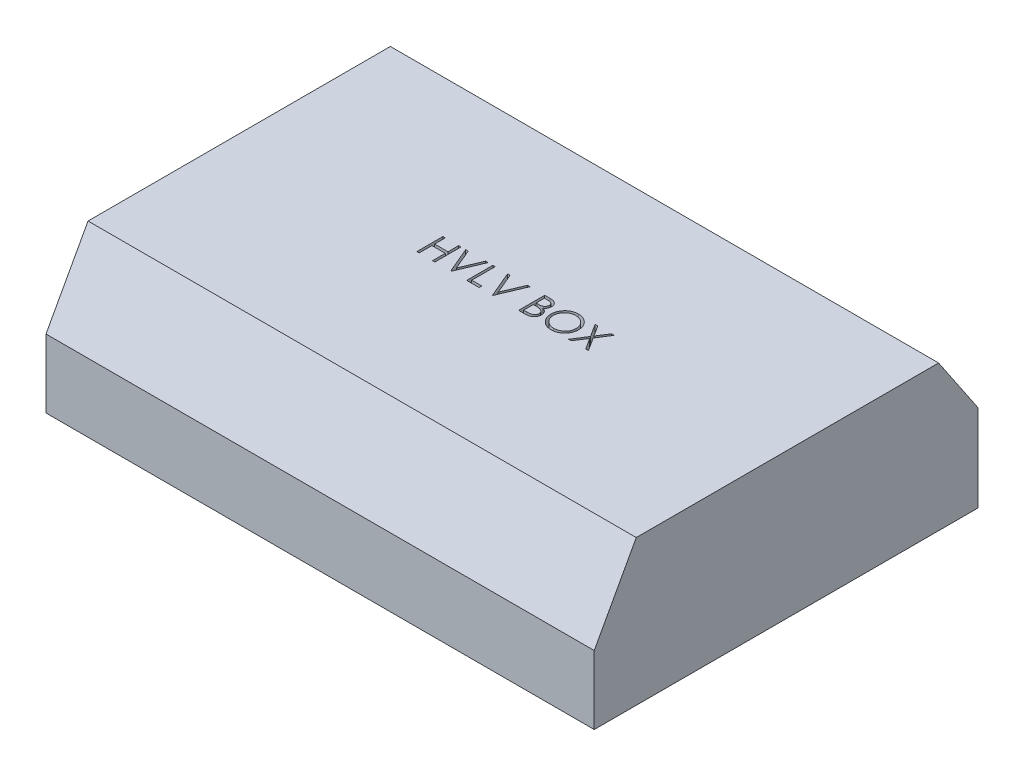
from build123d import *

# Parameters (mm, degrees)
BOSS_EXTRUDE1_DEPTH      = 53
BOSS_EXTRUDE1_DEPTH_BACK = 53
SKETCH1_W                = 400
SKETCH1_H                = 280
CUT_EXTRUDE1_DEPTH       = 53
CUT_EXTRUDE2_DEPTH       = 428.093666681


with BuildPart() as part:
    # Sketch1 → Boss-Extrude1 (new, two sides: drawn at the far end of the back side and taken through both)
    with BuildSketch(Plane(origin=(0, 0, 0), x_dir=(1, 0, 0), z_dir=(0, 1, 0)).offset(-BOSS_EXTRUDE1_DEPTH_BACK)):
        Rectangle(SKETCH1_W, SKETCH1_H)
    extrude(amount=BOSS_EXTRUDE1_DEPTH + BOSS_EXTRUDE1_DEPTH_BACK)

    # Sketch2 → Cut-Extrude1 (cut)
    # profile 1 of 7: a face of its own
    with BuildSketch(Plane(origin=(0, 53, 0), x_dir=(1, 0, 0), z_dir=(0, 1, 0))):
        Polygon((-60.725071742, 10.351541193), (-59.015456358, 10.351541193), (-59.015456358, 2.536156577), (-49.246225588, 2.536156577), (-49.246225588, 10.351541193), (-47.536610204, 10.351541193), (-47.536610204, -8.698458807), (-49.246225588, -8.698458807), (-49.246225588, 0.582310423), (-59.015456358, 0.582310423), (-59.015456358, -8.698458807), (-60.725071742, -8.698458807), align=None)
    # profile 2 of 7: a face of its own
    with BuildSketch(Plane(origin=(0, 53, 0), x_dir=(1, 0, 0), z_dir=(0, 1, 0))):
        Polygon((-44.117379435, 10.351541193), (-42.285648665, 10.351541193), (-35.935648665, -4.661018904), (-29.585648665, 10.351541193), (-27.753917896, 10.351541193), (-35.813533281, -8.698458807), (-36.05776405, -8.698458807), align=None)
    # profile 3 of 7: a face of its own
    with BuildSketch(Plane(origin=(0, 53, 0), x_dir=(1, 0, 0), z_dir=(0, 1, 0))):
        Polygon((-24.334687127, 10.351541193), (-22.625071742, 10.351541193), (-22.625071742, -6.744612654), (-15.298148665, -6.744612654), (-15.298148665, -8.698458807), (-24.334687127, -8.698458807), align=None)
    # profile 4 of 7: a face of its own
    with BuildSketch(Plane(origin=(0, 53, 0), x_dir=(1, 0, 0), z_dir=(0, 1, 0))):
        Polygon((-13.588533281, 10.351541193), (-11.756802512, 10.351541193), (-5.406802512, -4.661018904), (0.943197488, 10.351541193), (2.774928258, 10.351541193), (-5.284687127, -8.698458807), (-5.528917896, -8.698458807), align=None)
    # profile 5 of 7: a face of its own
    with BuildSketch(Plane(origin=(0, 53, 0), x_dir=(1, 0, 0), z_dir=(0, 1, 0))):
        with BuildLine():
            Line((13.521082104, 10.351541193), (17.237969123, 10.351541193))
            add(Edge.make_bspline(
                [(17.237969123, 10.351541193), (17.419915554, 10.350584608), (17.772573021, 10.34873051), (18.285395983, 10.319975182), (18.765721652, 10.280766636), (19.213689327, 10.218554274), (19.629092007, 10.143487601), (20.013181576, 10.052582002), (20.364736656, 9.943580005), (20.784450264, 9.770245246), (21.262989861, 9.512672001), (21.781141113, 9.132060811), (22.224212759, 8.666519833), (22.606226857, 8.141378523), (22.909944379, 7.563696679), (23.129668698, 6.947243095), (23.268776562, 6.299969042), (23.283082754, 5.855596888), (23.290312873, 5.631018356)],
                knots=[0, 0, 0, 0, 1.001505555, 1.941167018, 2.826882275, 3.653841531, 4.429895133, 5.150066043, 5.825578002, 6.45369114, 7.647487171, 8.808567382, 9.977351308, 11.170798116, 12.373658725, 13.556498008, 14.765093433, 16, 16, 16, 16], degree=3))
            add(Edge.make_bspline(
                [(23.290312873, 5.631018356), (23.284362641, 5.420638017), (23.272669875, 5.007220812), (23.16085857, 4.402551446), (22.985812646, 3.826962669), (22.742488362, 3.282555114), (22.426247497, 2.781629305), (22.051461505, 2.320144329), (21.599286337, 1.91763929), (21.260505274, 1.692615777), (21.088419844, 1.578314029)],
                knots=[0, 0, 0, 0, 1.044552857, 2.05264487, 3.044412934, 4.028983338, 5.005914585, 5.980388656, 6.974128949, 8, 8, 8, 8], degree=3))
            add(Edge.make_bspline(
                [(21.088419844, 1.578314029), (21.304830172, 1.495228821), (21.718876737, 1.336266235), (22.288667747, 1.055221781), (22.779585403, 0.749539437), (23.195404155, 0.415718939), (23.551027677, 0.055898126), (23.861558687, -0.335198996), (24.126524453, -0.762674236), (24.353561937, -1.222070621), (24.530720166, -1.708697256), (24.663394731, -2.217989623), (24.739417561, -2.748121488), (24.750236009, -3.108903338), (24.755697488, -3.291036932)],
                knots=[0, 0, 0, 0, 1.27268992, 2.434971085, 3.483601985, 4.442670788, 5.356604649, 6.2567628, 7.179492994, 8.113709626, 9.066344395, 10.018646069, 10.999752585, 12, 12, 12, 12], degree=3))
            add(Edge.make_bspline(
                [(24.755697488, -3.291036932), (24.750380655, -3.477002336), (24.739919637, -3.842894479), (24.662740076, -4.380404568), (24.532061936, -4.89407392), (24.352060411, -5.387224986), (24.117134099, -5.858903718), (23.831231893, -6.309644484), (23.490337239, -6.734918483), (23.108995053, -7.139451346), (22.677582518, -7.503185446), (22.21213248, -7.827120935), (21.706783225, -8.093527359), (21.169834515, -8.31731599), (20.595263023, -8.488260884), (19.985648831, -8.607854465), (19.341517703, -8.688436167), (18.899504629, -8.695061239), (18.672824892, -8.698458807)],
                knots=[0, 0, 0, 0, 0.978564426, 1.925352924, 2.850884081, 3.763762016, 4.682927383, 5.618979971, 6.567305752, 7.547517671, 8.540179244, 9.531824382, 10.526200242, 11.540722885, 12.589160233, 13.674978461, 14.80764778, 16, 16, 16, 16], degree=3))
            Line((18.672824892, -8.698458807), (13.521082104, -8.698458807))
            Line((13.521082104, -8.698458807), (13.521082104, 10.351541193))
        make_face()
        with BuildLine():
            Line((15.230697488, 8.397695039), (15.230697488, 2.291925808))
            Line((15.230697488, 2.291925808), (16.379345325, 2.291925808))
            add(Edge.make_bspline(
                [(16.379345325, 2.291925808), (16.547250911, 2.294102532), (16.871678721, 2.298308406), (17.341505586, 2.310356263), (17.777614614, 2.344091328), (18.17925302, 2.377816697), (18.545788322, 2.432651238), (18.876408482, 2.49792265), (19.176302274, 2.566953891), (19.522138944, 2.684353527), (19.914421706, 2.857859159), (20.332613316, 3.127127295), (20.701282357, 3.447844132), (21.012598479, 3.817909224), (21.267386626, 4.225395178), (21.444354132, 4.663800342), (21.564354351, 5.122198489), (21.575193971, 5.436894979), (21.580697488, 5.596673404)],
                knots=[0, 0, 0, 0, 1.156816544, 2.235205308, 3.236616184, 4.169592532, 5.011045266, 5.787822928, 6.49130361, 7.128639758, 8.301311294, 9.436451833, 10.541879658, 11.654887649, 12.756523258, 13.837046038, 14.901820046, 16, 16, 16, 16], degree=3))
            add(Edge.make_bspline(
                [(21.580697488, 5.596673404), (21.577833565, 5.702405103), (21.572215666, 5.909809377), (21.526205548, 6.212156576), (21.448004892, 6.496511858), (21.347560811, 6.766772087), (21.207196662, 7.014486586), (21.041932669, 7.248220265), (20.842257698, 7.460013367), (20.61497861, 7.657967351), (20.353674534, 7.83346971), (20.05850136, 7.987180149), (19.725465575, 8.110954948), (19.360179893, 8.219355721), (18.957021545, 8.295492006), (18.520642905, 8.35891973), (18.047469648, 8.391210797), (17.720108447, 8.395485415), (17.550889796, 8.397695039)],
                knots=[0, 0, 0, 0, 0.91205012, 1.789085906, 2.630437955, 3.453916878, 4.269457761, 5.079663411, 5.91843418, 6.774407191, 7.675494373, 8.627863946, 9.638891023, 10.736472738, 11.911756761, 13.175263542, 14.539845004, 16, 16, 16, 16], degree=3))
            Line((17.550889796, 8.397695039), (15.230697488, 8.397695039))
        make_face(mode=Mode.SUBTRACT)
        with BuildLine():
            Line((15.230697488, 0.338079654), (15.230697488, -6.744612654))
            Line((15.230697488, -6.744612654), (17.665372969, -6.744612654))
            add(Edge.make_bspline(
                [(17.665372969, -6.744612654), (17.839647409, -6.742523971), (18.175538416, -6.738498312), (18.660503683, -6.725356236), (19.109991719, -6.695462564), (19.52195143, -6.648404439), (19.900831179, -6.59735888), (20.24208582, -6.52871748), (20.54848163, -6.450073852), (20.903760362, -6.328512143), (21.303829457, -6.139664208), (21.734962833, -5.854925348), (22.118282677, -5.515708487), (22.443794159, -5.123110225), (22.710564854, -4.696219717), (22.904632402, -4.243671455), (23.024325494, -3.772943085), (23.038815301, -3.451995692), (23.046082104, -3.291036932)],
                knots=[0, 0, 0, 0, 1.160039823, 2.235823828, 3.228722157, 4.157150951, 4.99529583, 5.772374946, 6.472645482, 7.099169577, 8.269452708, 9.405989375, 10.527446681, 11.663510218, 12.788923519, 13.866172445, 14.929861265, 16, 16, 16, 16], degree=3))
            add(Edge.make_bspline(
                [(23.046082104, -3.291036932), (23.044579307, -3.190380322), (23.041597955, -2.990690701), (22.996636608, -2.697234599), (22.931246831, -2.412976632), (22.846711455, -2.13714493), (22.723596927, -1.87472641), (22.579869875, -1.62053105), (22.411351389, -1.374222827), (22.148765286, -1.062824704), (21.766829199, -0.70404782), (21.224139464, -0.352779415), (20.607070242, -0.069490636), (20.159517745, 0.050793657), (19.92832369, 0.112929414)],
                knots=[0, 0, 0, 0, 0.723448775, 1.435228256, 2.130040452, 2.821711965, 3.505591119, 4.210454504, 4.921174351, 5.648778258, 7.137944449, 8.670945889, 10.280296675, 12, 12, 12, 12], degree=3))
            add(Edge.make_bspline(
                [(19.92832369, 0.112929414), (19.835636754, 0.131734942), (19.634672359, 0.172509207), (19.3069711, 0.215549707), (18.932851585, 0.253894961), (18.511449924, 0.282258548), (18.042232961, 0.311576735), (17.524198589, 0.322978547), (16.959462348, 0.336581663), (16.567618149, 0.33756755), (16.364080902, 0.338079654)],
                knots=[0, 0, 0, 0, 0.634451884, 1.375622551, 2.216452059, 3.157844607, 4.20941857, 5.370758133, 6.634282058, 8, 8, 8, 8], degree=3))
            Line((16.364080902, 0.338079654), (15.230697488, 0.338079654))
        make_face(mode=Mode.SUBTRACT)
    # profile 6 of 7: a face of its own
    with BuildSketch(Plane(origin=(0, 53, 0), x_dir=(1, 0, 0), z_dir=(0, 1, 0))):
        with BuildLine():
            add(Edge.make_bspline(
                [(37.577812873, 10.840002731), (37.930554135, 10.831068393), (38.623367077, 10.813520617), (39.64158902, 10.679195782), (40.61365661, 10.446810874), (41.547488366, 10.137313783), (42.431914424, 9.7244492), (43.273591824, 9.225420035), (44.070517952, 8.634998167), (44.811951471, 7.957747661), (45.490441444, 7.220874862), (46.088208053, 6.434502237), (46.589181109, 5.60338447), (47.000583751, 4.730019092), (47.323337612, 3.816381266), (47.546054121, 2.857600194), (47.688320338, 1.859888067), (47.704952498, 1.179384703), (47.713389796, 0.834173404)],
                knots=[0, 0, 0, 0, 1.065120563, 2.091984664, 3.0946048, 4.079830382, 5.057816894, 6.036188127, 7.030412546, 8.04752943, 9.064399622, 10.05169764, 11.02544977, 11.989514704, 12.962713494, 13.945757189, 14.957906945, 16, 16, 16, 16], degree=3))
            add(Edge.make_bspline(
                [(47.713389796, 0.834173404), (47.704953735, 0.491505018), (47.688325281, -0.183934071), (47.545892363, -1.175314817), (47.322512063, -2.128308465), (47.003580957, -3.041324089), (46.594139424, -3.915324829), (46.089830564, -4.748010964), (45.495790546, -5.539655477), (44.8197504, -6.28158584), (44.082781871, -6.961929216), (43.292314276, -7.554759097), (42.46612492, -8.064886118), (41.59358208, -8.471922972), (40.686257594, -8.797252996), (39.73603095, -9.01906374), (38.747354706, -9.162140361), (38.073142528, -9.178569712), (37.730457104, -9.186920346)],
                knots=[0, 0, 0, 0, 1.043624062, 2.057103931, 3.04512605, 4.022047818, 4.998200453, 5.980619268, 6.982898556, 8.009068085, 9.034988726, 10.034168286, 11.015286542, 11.987931943, 12.962482838, 13.94673481, 14.956375938, 16, 16, 16, 16], degree=3))
            add(Edge.make_bspline(
                [(37.730457104, -9.186920346), (37.385247596, -9.178487255), (36.704747764, -9.161863387), (35.7057819, -9.019361741), (34.746327323, -8.796524073), (33.829127782, -8.47806557), (32.953671808, -8.066491786), (32.118247215, -7.564636522), (31.326207285, -6.969149082), (30.584118637, -6.293328155), (29.905126572, -5.557608708), (29.313164828, -4.769296548), (28.811196711, -3.943857563), (28.401004858, -3.079001038), (28.076259729, -2.1789079), (27.854709219, -1.237574044), (27.711366394, -0.260366163), (27.694848159, 0.40498447), (27.686466719, 0.742586866)],
                knots=[0, 0, 0, 0, 1.053102029, 2.075944431, 3.073151272, 4.055350789, 5.033113405, 6.020478099, 7.024410459, 8.052272461, 9.079885166, 10.07527673, 11.055994387, 12.023226415, 12.992069828, 13.970394897, 14.97016774, 16, 16, 16, 16], degree=3))
            add(Edge.make_bspline(
                [(27.686466719, 0.742586866), (27.689376664, 0.969187536), (27.695159843, 1.419530209), (27.764783198, 2.088275561), (27.865811886, 2.746266141), (28.010602295, 3.391630872), (28.199968369, 4.022789946), (28.423408689, 4.644096241), (28.696312705, 5.249253366), (29.004817375, 5.841128112), (29.349142358, 6.410493999), (29.72946608, 6.948681445), (30.132430014, 7.460206585), (30.574190771, 7.931813848), (31.040188851, 8.377222749), (31.537983738, 8.789588395), (32.064537954, 9.172629199), (32.622117192, 9.517817056), (33.196982374, 9.830014631), (33.789583122, 10.097922135), (34.391871032, 10.327861412), (35.006667045, 10.514229332), (35.632338561, 10.661360843), (36.270251132, 10.761549439), (36.919896552, 10.831350369), (37.357563874, 10.837106202), (37.577812873, 10.840002731)],
                knots=[0, 0, 0, 0, 1.037015668, 2.060948919, 3.074880161, 4.083647147, 5.086022904, 6.090072063, 7.104153813, 8.122640571, 9.144368836, 10.147691507, 11.138137339, 12.123020368, 13.103399296, 14.087645067, 15.080126199, 16.082011238, 17.087798457, 18.072939717, 19.057185487, 20.037253025, 21.01195951, 21.997135196, 22.992090687, 24, 24, 24, 24], degree=3))
        make_face()
        with BuildLine():
            add(Edge.make_bspline(
                [(37.6617672, 8.886156577), (37.480984695, 8.883952817), (37.121147977, 8.879566366), (36.586199287, 8.821786543), (36.058286047, 8.739436718), (35.537299233, 8.621971584), (35.025418715, 8.461929525), (34.517873151, 8.277738296), (34.019290815, 8.053377789), (33.531317674, 7.799889212), (33.058251336, 7.519315801), (32.611867918, 7.209226611), (32.191011813, 6.876893623), (31.796713462, 6.521541251), (31.430130654, 6.141359847), (31.084048207, 5.742113016), (30.772338056, 5.312389152), (30.486666559, 4.863841081), (30.231027314, 4.397053046), (30.003704455, 3.916939367), (29.817754635, 3.419583672), (29.666103701, 2.910381757), (29.540374731, 2.390140083), (29.460724373, 1.854912106), (29.402309673, 1.307387282), (29.398173943, 0.937371762), (29.396082104, 0.750219077)],
                knots=[0, 0, 0, 0, 1.008559885, 2.007477868, 2.99961109, 3.989939068, 4.984837346, 5.991145699, 7.001802488, 8.033829008, 9.059044045, 10.069351652, 11.065060232, 12.050310815, 13.029377138, 14.011219647, 14.996725999, 15.989392538, 16.977580475, 17.965360261, 18.951710183, 19.937753436, 20.929683414, 21.935841486, 22.955955122, 24, 24, 24, 24], degree=3))
            add(Edge.make_bspline(
                [(29.396082104, 0.750219077), (29.403020995, 0.475016133), (29.416671942, -0.066393196), (29.536183859, -0.85978838), (29.720272034, -1.62226891), (29.991638557, -2.34966273), (30.331004046, -3.048222327), (30.750250405, -3.711750725), (31.246960571, -4.340427255), (31.811186337, -4.929862934), (32.42798564, -5.467866525), (33.082939499, -5.940107364), (33.769031277, -6.339668866), (34.488050137, -6.665179332), (35.236157457, -6.923114905), (36.018173842, -7.099891454), (36.828889915, -7.216235004), (37.381506767, -7.227407861), (37.6617672, -7.233074192)],
                knots=[0, 0, 0, 0, 1.032063989, 2.030389145, 3.003944642, 3.970395727, 4.937377036, 5.913328081, 6.909231446, 7.93887556, 8.970685674, 9.976071282, 10.964166581, 11.944589148, 12.933237628, 13.927779006, 14.949070134, 16, 16, 16, 16], degree=3))
            add(Edge.make_bspline(
                [(37.6617672, -7.233074192), (37.850141773, -7.23048609), (38.223745128, -7.225353105), (38.779436471, -7.173653164), (39.325116709, -7.090748275), (39.860020461, -6.97138285), (40.383540649, -6.821991626), (40.897862363, -6.644512421), (41.397507343, -6.423090441), (41.888778746, -6.178445162), (42.359021147, -5.899552304), (42.807923687, -5.599987518), (43.224171521, -5.268144025), (43.618174895, -4.91807136), (43.986262745, -4.542710988), (44.325945931, -4.142550924), (44.63608065, -3.715065346), (44.921643669, -3.267197638), (45.176387142, -2.79913232), (45.398341953, -2.31727793), (45.586643669, -1.822820977), (45.738654531, -1.315048281), (45.857773973, -0.794924233), (45.939851822, -0.261752407), (45.997265467, 0.283400585), (46.001592959, 0.652120716), (46.003774412, 0.83798951)],
                knots=[0, 0, 0, 0, 1.047197238, 2.076906641, 3.100256066, 4.114471768, 5.12198147, 6.126382909, 7.136867548, 8.15857795, 9.17633901, 10.174870724, 11.156907918, 12.133735059, 13.104061851, 14.077631395, 15.04955518, 16.038496417, 17.029181396, 18.010275684, 18.986308667, 19.968651475, 20.955262928, 21.950658345, 22.966943676, 24, 24, 24, 24], degree=3))
            add(Edge.make_bspline(
                [(46.003774412, 0.83798951), (46.001591211, 1.022586755), (45.99726043, 1.388769393), (45.939879247, 1.930120419), (45.857687258, 2.459455756), (45.739235947, 2.974697312), (45.586562967, 3.475976427), (45.398309069, 3.962822297), (45.176320511, 4.437048616), (44.921550032, 4.897483289), (44.635169622, 5.339305792), (44.322236669, 5.761684637), (43.977348131, 6.156687701), (43.61035791, 6.534066535), (43.212099234, 6.885772477), (42.784376148, 7.211922197), (42.332381273, 7.520386733), (41.853805892, 7.798655862), (41.359899515, 8.055636186), (40.853093544, 8.275805217), (40.339129444, 8.462887753), (39.819314204, 8.622455805), (39.289272565, 8.738976655), (38.752586011, 8.821860755), (38.209997061, 8.879546255), (37.845090393, 8.883946144), (37.6617672, 8.886156577)],
                knots=[0, 0, 0, 0, 1.02996197, 2.043119294, 3.035359645, 4.018872909, 4.991431989, 5.957985074, 6.929999688, 7.912076566, 8.892894881, 9.867085534, 10.843653904, 11.817741046, 12.803660682, 13.806313499, 14.818574707, 15.856120519, 16.894564902, 17.924820532, 18.937903209, 19.946497019, 20.957711757, 21.963978472, 22.977135795, 24, 24, 24, 24], degree=3))
        make_face(mode=Mode.SUBTRACT)
    # profile 7 of 7: a face of its own
    with BuildSketch(Plane(origin=(0, 53, 0), x_dir=(1, 0, 0), z_dir=(0, 1, 0))):
        Polygon((50.277812873, 10.351541193), (52.250739556, 10.351541193), (57.238389796, 2.559053212), (62.226040037, 10.351541193), (64.198966719, 10.351541193), (58.22676119, 1.017346481), (64.443197488, -8.698458807), (62.470270806, -8.698458807), (57.238389796, -0.52436025), (52.006508787, -8.698458807), (50.033582104, -8.698458807), (56.253834508, 1.017346481), align=None)
    extrude(amount=-CUT_EXTRUDE1_DEPTH, mode=Mode.SUBTRACT)

    # Sketch3 → Cut-Extrude2 (cut, through all)
    with BuildSketch(Plane.ZY.offset(200)):
        Polygon((-140, 10.37037037), (-111.25743027, 53), (-140, 53), align=None)
        Polygon((109.336991312, 53), (140, 53), (140, -3.072702332), align=None)
    extrude(amount=-CUT_EXTRUDE2_DEPTH, mode=Mode.SUBTRACT)


solid = part.part
